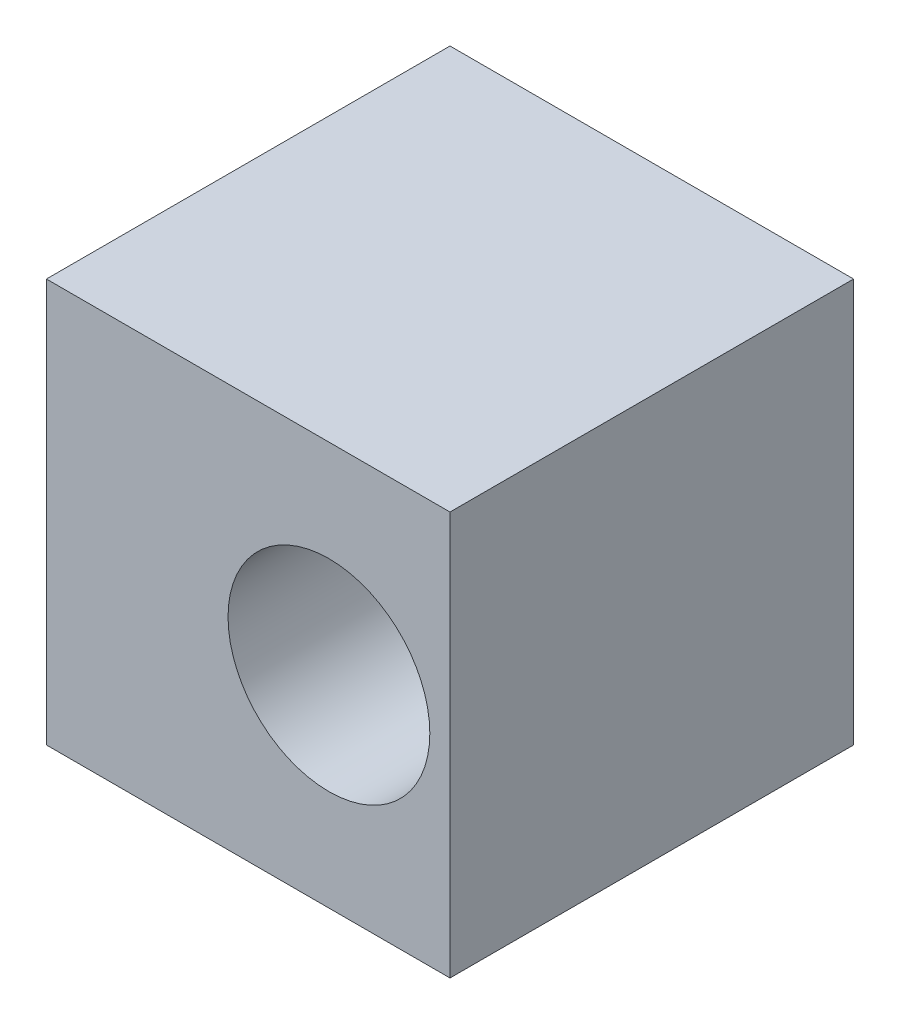
from build123d import *

# Parameters (mm, degrees)
SKETCH1_W           = 10
SKETCH1_H           = 10
BOSS_EXTRUDE1_DEPTH = 10
SKETCH2_R           = 2.5
CUT_EXTRUDE1_DEPTH  = 18.320508076


with BuildPart() as part:
    # Sketch1 → Boss-Extrude1 (new body)
    with BuildSketch(Plane.XY):
        with Locations((5, 5)):
            Rectangle(SKETCH1_W, SKETCH1_H)
    extrude(amount=BOSS_EXTRUDE1_DEPTH)

    # Sketch2 → Cut-Extrude1 (cut, through all)
    with BuildSketch(Plane.XY.offset(10)):
        with Locations((7, 5)):
            Circle(SKETCH2_R)
    extrude(amount=-CUT_EXTRUDE1_DEPTH, mode=Mode.SUBTRACT)


solid = part.part
